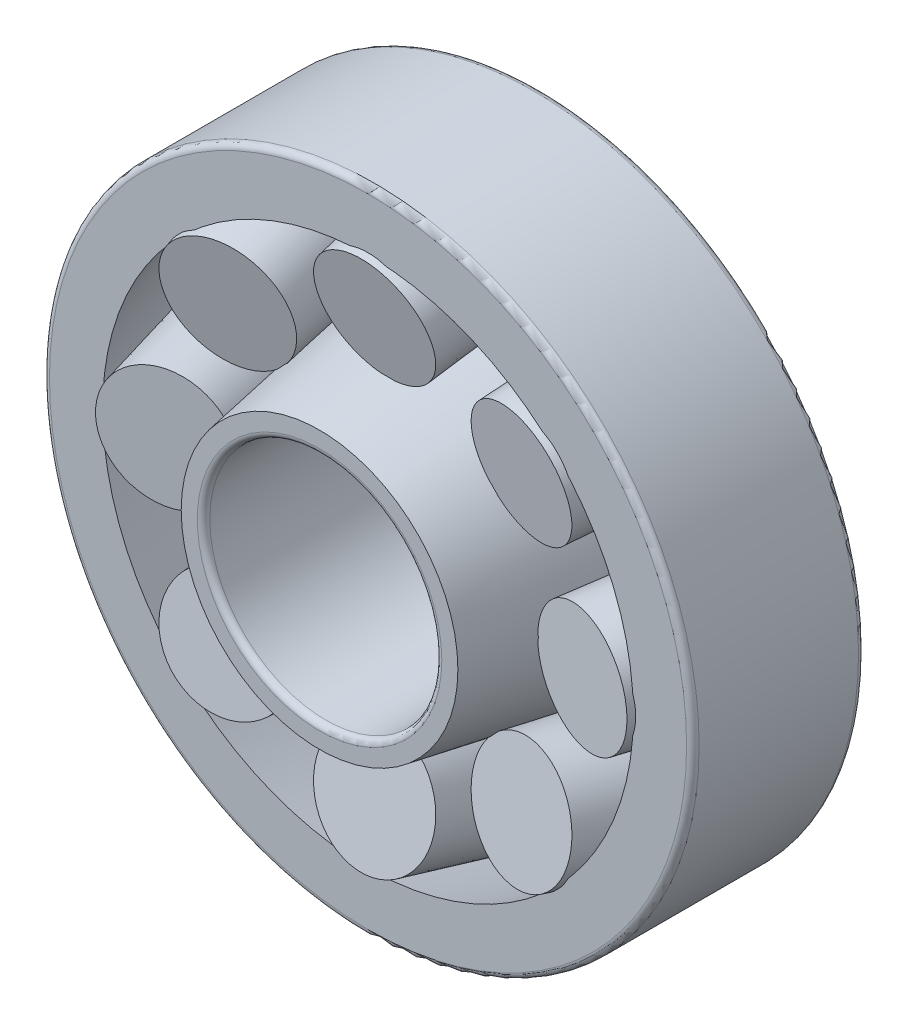
from build123d import *

# Parameters (mm, degrees)
ROLLERSPATTERN_COUNT = 8
FILLET_F1_R          = 0.405
FILLET_F2_R          = 0.405


with BuildPart() as part:
    # ConeS → Cone (revolve)
    with BuildSketch(Plane(origin=(0, 0, 0), x_dir=(1, 0, 0), z_dir=(0, 1, 0))):
        Polygon((7.5, -7.125), (8.94367725, -7.125), (11.20506675, 5.7), (7.5, 5.7), align=None)
    revolve(axis=Axis((0, 0, 11.6875), (0, 0, -1)))

    # Fillet F2
    fillet_f2_edges = [part.edges().sort_by_distance(p)[0] for p in [
        (-7.5, 0, -5.7),
        (-7.5, 0, 7.125),
    ]]
    fillet(fillet_f2_edges, radius=FILLET_F2_R)


with BuildPart() as body_2:
    # CupS → Cup (revolve)
    with BuildSketch(Plane(origin=(0, 0, 0), x_dir=(1, 0, 0), z_dir=(0, 1, 0))):
        Polygon((17.15588175, -3.99), (21, -3.99), (21, 7.125), (20.34306525, 7.125), align=None)
    revolve(axis=Axis((0, 0, 11.6875), (0, 0, -1)))

    # Fillet F1
    fillet_f1_edges = [body_2.edges().sort_by_distance(p)[0] for p in [
        (-21, 0, -7.125),
        (-21, 0, 3.99),
    ]]
    fillet(fillet_f1_edges, radius=FILLET_F1_R)


with BuildPart() as body_3:
    # RollerS → Roller (revolve)
    with BuildSketch(Plane(origin=(0, 0, 0), x_dir=(1, 0, 0), z_dir=(0, 1, 0))):
        Polygon((13.425153, -3.5625), (17.17915665, -4.43169015), (19.61867115, 4.01183385), (15.4047915, 4.9875), align=None)
    revolve(axis=Axis((15.4047915, 0, -4.9875), (-0.22556930102161163, 0, 0.9742271246668416)))


with BuildPart() as rollerspattern_1:
    # RollersPattern: pattern copy
    add(body_3.part.rotate(Axis((0, 0, -7.8375), (0, 0, 1)), 1 * 360 / ROLLERSPATTERN_COUNT))


with BuildPart() as rollerspattern_2:
    # RollersPattern: pattern copy
    add(body_3.part.rotate(Axis((0, 0, -7.8375), (0, 0, 1)), 2 * 360 / ROLLERSPATTERN_COUNT))


with BuildPart() as rollerspattern_3:
    # RollersPattern: pattern copy
    add(body_3.part.rotate(Axis((0, 0, -7.8375), (0, 0, 1)), 3 * 360 / ROLLERSPATTERN_COUNT))


with BuildPart() as rollerspattern_4:
    # RollersPattern: pattern copy
    add(body_3.part.rotate(Axis((0, 0, -7.8375), (0, 0, 1)), 4 * 360 / ROLLERSPATTERN_COUNT))


with BuildPart() as rollerspattern_5:
    # RollersPattern: pattern copy
    add(body_3.part.rotate(Axis((0, 0, -7.8375), (0, 0, 1)), 5 * 360 / ROLLERSPATTERN_COUNT))


with BuildPart() as rollerspattern_6:
    # RollersPattern: pattern copy
    add(body_3.part.rotate(Axis((0, 0, -7.8375), (0, 0, 1)), 6 * 360 / ROLLERSPATTERN_COUNT))


with BuildPart() as rollerspattern_7:
    # RollersPattern: pattern copy
    add(body_3.part.rotate(Axis((0, 0, -7.8375), (0, 0, 1)), 7 * 360 / ROLLERSPATTERN_COUNT))


solid = Compound([part.part, body_2.part, body_3.part, rollerspattern_1.part, rollerspattern_2.part, rollerspattern_3.part, rollerspattern_4.part, rollerspattern_5.part, rollerspattern_6.part, rollerspattern_7.part])
